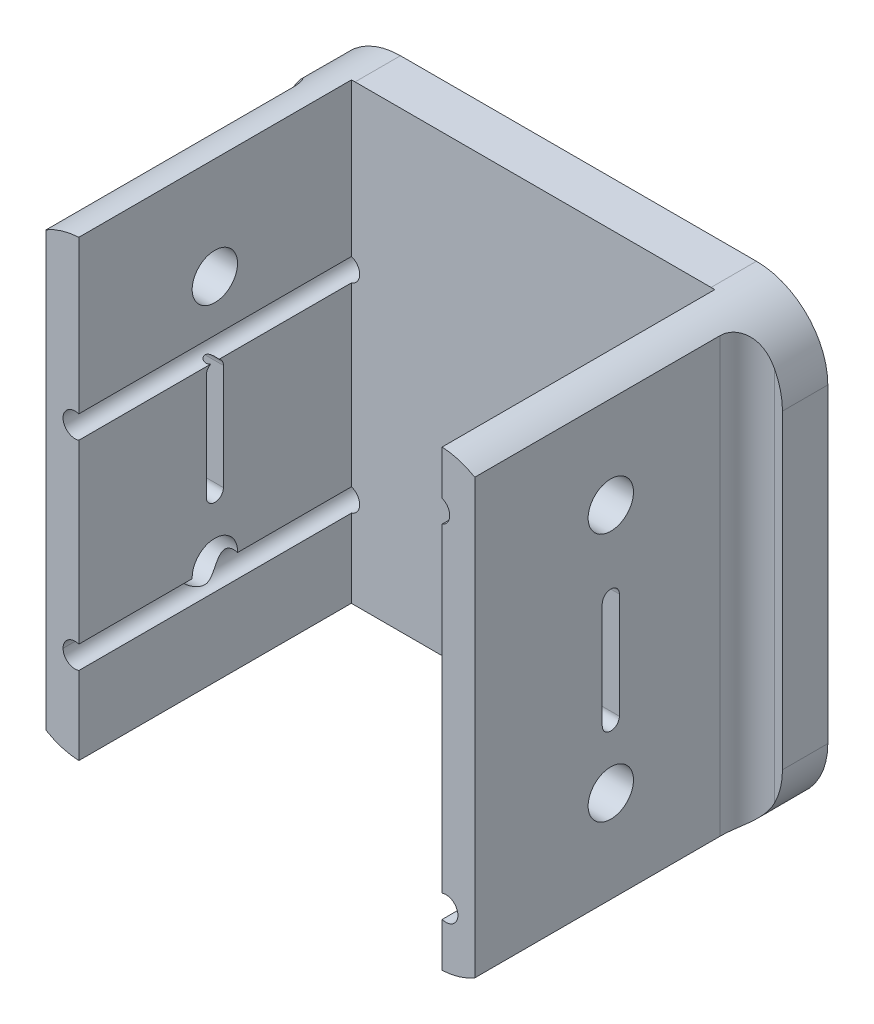
from build123d import *

# Parameters (mm, degrees)
BOSS_EXTRUDE2_DEPTH = 63.5
SKETCH4_R           = 3.175
CUT_EXTRUDE1_DEPTH  = 99.520248977
CUT_EXTRUDE2_REACH  = 100.278
SKETCH5_R           = 1.68275
FILLET1_R           = 10
CUT_EXTRUDE3_DEPTH  = 99.520249146


with BuildPart() as part:
    # Sketch3 → Boss-Extrude2 (new body)
    with BuildSketch(Plane(origin=(0, 0, 0), x_dir=(1, 0, 0), z_dir=(0, 1, 0))):
        with BuildLine():
            Line((-9.4869, 0), (-8.382, 0))
            ThreePointArc((-8.382, 0), (-5.687923164, -1.115923164), (-4.572, -3.81))
            Line((-4.572, -3.81), (-4.572, -38.1762))
            Line((-4.572, -38.1762), (0, -38.1762))
            Line((0, -38.1762), (0, 0))
            Line((0, 0), (50.8762, 0))
            Line((50.8762, 0), (50.8762, -38.1762))
            Line((50.8762, -38.1762), (55.4482, -38.1762))
            Line((55.4482, -38.1762), (55.4482, -3.81))
            ThreePointArc((55.4482, -3.81), (56.564123164, -1.115923164), (59.2582, 0))
            Line((59.2582, 0), (60.3631, 0))
            Line((60.3631, 0), (60.3631, 6.35))
            Line((60.3631, 6.35), (-9.4869, 6.35))
            Line((-9.4869, 6.35), (-9.4869, 0))
        make_face()
    extrude(amount=BOSS_EXTRUDE2_DEPTH)

    # Sketch4 → Cut-Extrude1 (cut, through all)
    with BuildSketch(Plane(origin=(55.4482, 0, 0), x_dir=(0, 0, -1), z_dir=(1, 0, 0))):
        with Locations((-19.1262, 49.2125)):
            Circle(SKETCH4_R)
        with Locations((-19.1262, 14.2875)):
            Circle(SKETCH4_R)
    extrude(amount=-CUT_EXTRUDE1_DEPTH, mode=Mode.SUBTRACT)

    # Sketch5 → Cut-Extrude2 (cut, up to next)
    with BuildSketch(Plane(origin=(0, 0, -6.35), x_dir=(-1, 0, 0), z_dir=(0, 0, -1)), mode=Mode.PRIVATE) as cut_extrude2_sk1:
        with Locations((0.52705, 12.54125)):
            Circle(SKETCH5_R)
    cut_extrude2_tool1 = extrude(cut_extrude2_sk1.sketch, amount=-CUT_EXTRUDE2_REACH, mode=Mode.PRIVATE) & part.part
    # Sketch5 → Cut-Extrude2 (cut, up to next)
    with BuildSketch(Plane(origin=(0, 0, -6.35), x_dir=(-1, 0, 0), z_dir=(0, 0, -1)), mode=Mode.PRIVATE) as cut_extrude2_sk2:
        with Locations((-51.40325, 7.79145)):
            Circle(SKETCH5_R)
    cut_extrude2_tool2 = extrude(cut_extrude2_sk2.sketch, amount=-CUT_EXTRUDE2_REACH, mode=Mode.PRIVATE) & part.part
    # Sketch5 → Cut-Extrude2 (cut, up to next)
    with BuildSketch(Plane(origin=(0, 0, -6.35), x_dir=(-1, 0, 0), z_dir=(0, 0, -1)), mode=Mode.PRIVATE) as cut_extrude2_sk3:
        with Locations((-50.26025, 55.70855)):
            Circle(SKETCH5_R)
    cut_extrude2_tool3 = extrude(cut_extrude2_sk3.sketch, amount=-CUT_EXTRUDE2_REACH, mode=Mode.PRIVATE) & part.part
    # Sketch5 → Cut-Extrude2 (cut, up to next)
    with BuildSketch(Plane(origin=(0, 0, -6.35), x_dir=(-1, 0, 0), z_dir=(0, 0, -1)), mode=Mode.PRIVATE) as cut_extrude2_sk4:
        with Locations((0.52705, 40.46855)):
            Circle(SKETCH5_R)
    cut_extrude2_tool4 = extrude(cut_extrude2_sk4.sketch, amount=-CUT_EXTRUDE2_REACH, mode=Mode.PRIVATE) & part.part
    add(cut_extrude2_tool1.solids().sort_by_distance((-0.52705, 12.54125, -6.35))[0], mode=Mode.SUBTRACT)
    add(cut_extrude2_tool2.solids().sort_by_distance((51.40325, 7.79145, -6.35))[0], mode=Mode.SUBTRACT)
    add(cut_extrude2_tool3.solids().sort_by_distance((50.26025, 55.70855, -6.35))[0], mode=Mode.SUBTRACT)
    add(cut_extrude2_tool4.solids().sort_by_distance((-0.52705, 40.46855, -6.35))[0], mode=Mode.SUBTRACT)

    # Fillet1
    fillet1_edges = [part.edges().sort_by_distance(p)[0] for p in [
        (60.3631, 63.5, -3.175),
        (60.3631, 0, -3.175),
        (-9.4869, 0, -3.175),
        (-9.4869, 63.5, -3.175),
    ]]
    fillet(fillet1_edges, radius=FILLET1_R)

    # Sketch6 → Cut-Extrude3 (cut, through all)
    with BuildSketch(Plane.ZY.offset(4.572)):
        with BuildLine():
            Line((17.92732, 23.003265553), (17.92732, 37.822232766))
            ThreePointArc((17.92732, 37.822232766), (19.1262, 39.021112766), (20.32508, 37.822232766))
            Line((20.32508, 37.822232766), (20.32508, 23.003265553))
            ThreePointArc((20.32508, 23.003265553), (19.1262, 21.804385553), (17.92732, 23.003265553))
        make_face()
    extrude(amount=-CUT_EXTRUDE3_DEPTH, mode=Mode.SUBTRACT)


solid = part.part
